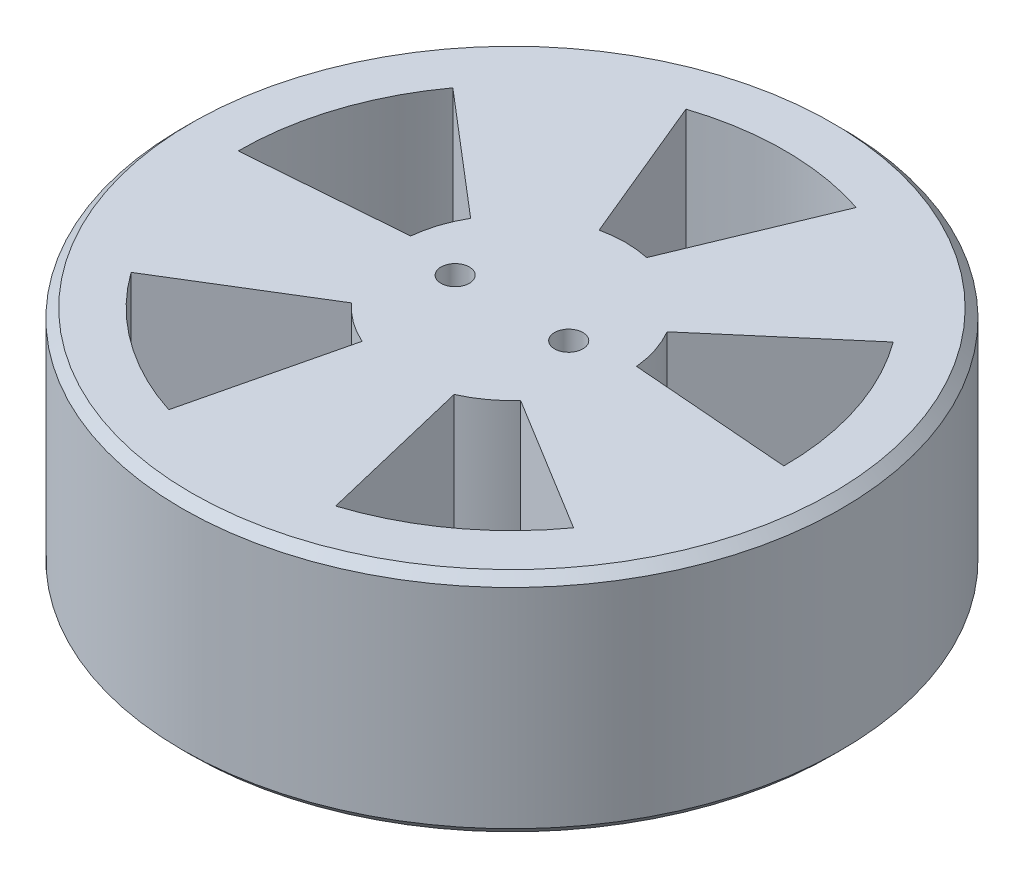
from build123d import *

# Parameters (mm, degrees)
SKETCH2_R               = 73.7235
BOSS_EXTRUDE1_DEPTH     = 50.8
CHAMFER1_SIZE           = 2.032
CUT_EXTRUDE1_DEPTH      = 116.978225993
CUT_EXTRUDE1_DEPTH_BACK = 116.978225993
SKETCH3_R               = 3.175
CUT_EXTRUDE2_DEPTH      = 116.978225993
CUT_EXTRUDE2_DEPTH_BACK = 116.978225993


with BuildPart() as part:
    # Sketch2 → Boss-Extrude1 (new body)
    with BuildSketch(Plane(origin=(0, 0, 0), x_dir=(1, 0, 0), z_dir=(0, 1, 0))):
        with Locations(Location((0, 0, 0), (0, 0, 270))):
            Circle(SKETCH2_R)
    extrude(amount=BOSS_EXTRUDE1_DEPTH)

    # Chamfer1
    chamfer1_edges = [part.edges().sort_by_distance(p)[0] for p in [
        (0, 0, -73.7235),
        (0, 50.8, -73.7235),
    ]]
    chamfer(chamfer1_edges, length=CHAMFER1_SIZE)

    # Sketch3 → Cut-Extrude1 (cut, two sides: drawn at the far end of the back side and taken through both)
    with BuildSketch(Plane(origin=(0, 50.8, 0), x_dir=(1, 0, 0), z_dir=(0, 1, 0)).offset(-CUT_EXTRUDE1_DEPTH_BACK)):
        with Locations(Location((-12.7, 0, 0), (0, 0, 270))):
            Circle(SKETCH3_R)
        with Locations(Location((12.7, 0, 0), (0, 0, 270))):
            Circle(SKETCH3_R)
    extrude(amount=CUT_EXTRUDE1_DEPTH + CUT_EXTRUDE1_DEPTH_BACK, mode=Mode.SUBTRACT)

    # Sketch4 → Cut-Extrude2 (cut, two sides: drawn at the far end of the back side and taken through both)
    with BuildSketch(Plane(origin=(0, 50.8, 0), x_dir=(1, 0, 0), z_dir=(0, 1, 0)).offset(-CUT_EXTRUDE2_DEPTH_BACK)):
        with BuildLine():
            Line((-5.323781477, 24.835807834), (-19.05, 57.973830754))
            ThreePointArc((-19.05, 57.973830754), (0, 61.0235), (19.05, 57.973830754))
            Line((19.05, 57.973830754), (5.323781477, 24.835807834))
            ThreePointArc((5.323781477, 24.835807834), (0, 25.4), (-5.323781477, 24.835807834))
        make_face()
        with BuildLine():
            Line((21.975117928, 12.737903755), (49.24961577, 36.032525567))
            ThreePointArc((49.24961577, 36.032525567), (58.036797322, 18.857298556), (61.023163256, -0.202727704))
            Line((61.023163256, -0.202727704), (25.265395829, 2.611469625))
            ThreePointArc((25.265395829, 2.611469625), (24.156835514, 7.849031657), (21.975117928, 12.737903755))
        make_face()
        with BuildLine():
            Line((18.905151263, -16.963350369), (49.487936479, -35.704505253))
            ThreePointArc((49.487936479, -35.704505253), (35.868713343, -49.369048556), (18.664388993, -58.099123365))
            Line((18.664388993, -58.099123365), (10.291091885, -23.221830845))
            ThreePointArc((10.291091885, -23.221830845), (14.929745408, -20.549031657), (18.905151263, -16.963350369))
        make_face()
        with BuildLine():
            Line((-10.291091885, -23.221830845), (-18.664388993, -58.099123365))
            ThreePointArc((-18.664388993, -58.099123365), (-35.868713343, -49.369048556), (-49.487936479, -35.704505253))
            Line((-49.487936479, -35.704505253), (-18.905151263, -16.963350369))
            ThreePointArc((-18.905151263, -16.963350369), (-14.929745408, -20.549031657), (-10.291091885, -23.221830845))
        make_face()
        with BuildLine():
            Line((-25.265395829, 2.611469625), (-61.023163256, -0.202727704))
            ThreePointArc((-61.023163256, -0.202727704), (-58.036797322, 18.857298556), (-49.24961577, 36.032525567))
            Line((-49.24961577, 36.032525567), (-21.975117928, 12.737903755))
            ThreePointArc((-21.975117928, 12.737903755), (-24.156835514, 7.849031657), (-25.265395829, 2.611469625))
        make_face()
    extrude(amount=CUT_EXTRUDE2_DEPTH + CUT_EXTRUDE2_DEPTH_BACK, mode=Mode.SUBTRACT)


solid = part.part
